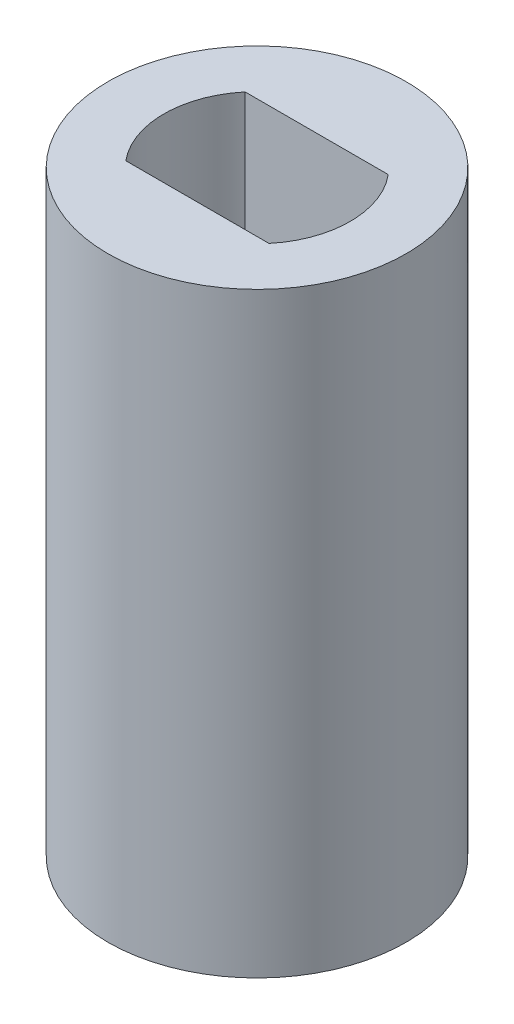
from build123d import *

# Parameters (mm, degrees)
SKETCH1_R           = 4
SKETCH1_R_2         = 2.5
BOSS_EXTRUDE1_DEPTH = 11
SKETCH2_R           = 4
BOSS_EXTRUDE2_DEPTH = 5


with BuildPart() as part:
    # Sketch1 → Boss-Extrude1 (new body)
    with BuildSketch(Plane(origin=(0, 0, 0), x_dir=(1, 0, 0), z_dir=(0, 1, 0))):
        with Locations(Location((0, 0, 0), (0, 0, 270))):
            Circle(SKETCH1_R)
        with Locations(Location((0, 0, 0), (0, 0, 270))):
            Circle(SKETCH1_R_2, mode=Mode.SUBTRACT)
    extrude(amount=BOSS_EXTRUDE1_DEPTH)

    # Sketch2 → Boss-Extrude2 (add)
    with BuildSketch(Plane(origin=(0, 11, 0), x_dir=(1, 0, 0), z_dir=(0, 1, 0))):
        with Locations(Location((0, 0, 0), (0, 0, 270))):
            Circle(SKETCH2_R)
        with BuildLine():
            Line((1.920937271, 1.6), (-1.920937271, 1.6))
            ThreePointArc((-1.920937271, 1.6), (-2.5, 0), (-1.920937271, -1.6))
            Line((-1.920937271, -1.6), (1.920937271, -1.6))
            ThreePointArc((1.920937271, -1.6), (2.5, 0), (1.920937271, 1.6))
        make_face(mode=Mode.SUBTRACT)
    extrude(amount=BOSS_EXTRUDE2_DEPTH)


solid = part.part
